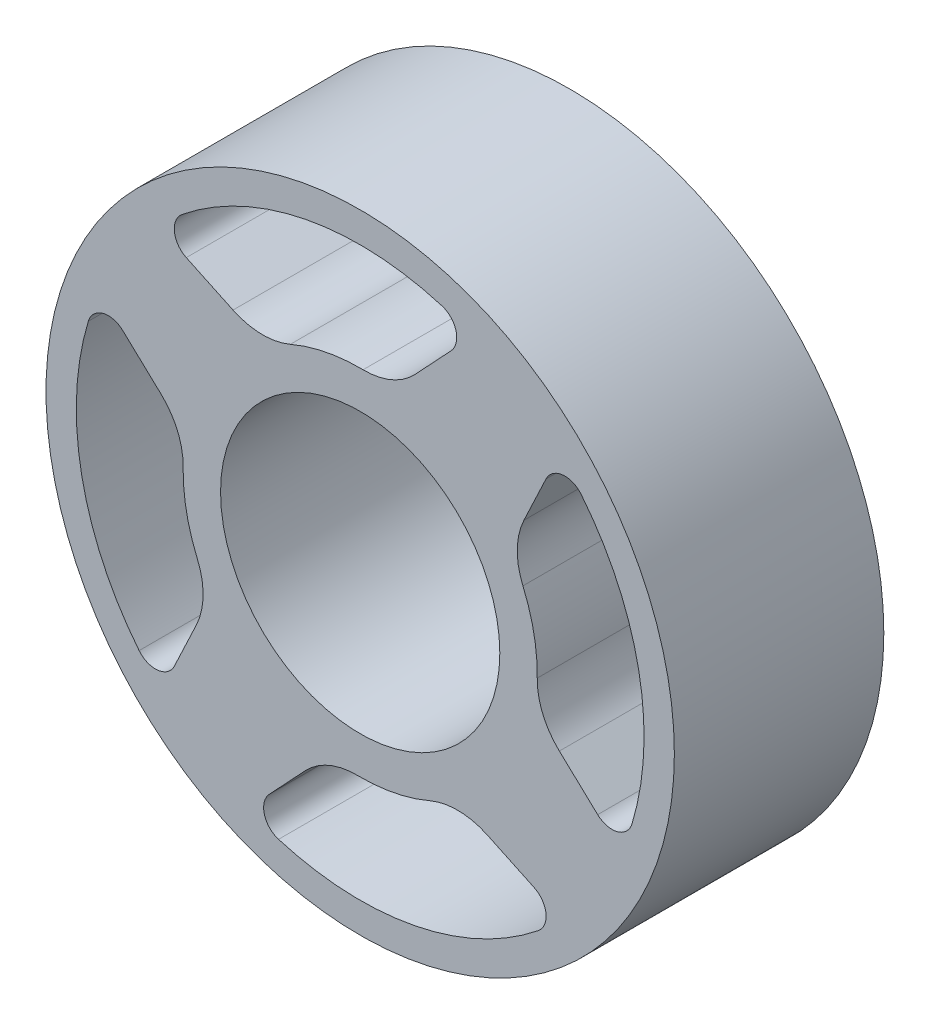
from build123d import *

# Parameters (mm, degrees)
SKETCH1_R           = 45
SKETCH1_R_2         = 20
BOSS_EXTRUDE1_DEPTH = 30
CUT_EXTRUDE1_DEPTH  = 30


with BuildPart() as part:
    # Sketch1 → Boss-Extrude1 (new body)
    with BuildSketch(Plane.XY):
        Circle(SKETCH1_R)
        Circle(SKETCH1_R_2, mode=Mode.SUBTRACT)
    extrude(amount=BOSS_EXTRUDE1_DEPTH)

    # Sketch2 → Cut-Extrude1 (cut)
    with BuildSketch(Plane.XY.offset(30)):
        with BuildLine():
            Line((-24.907553239, 26.610521963), (-18.211403795, 23.452988079))
            ThreePointArc((-18.211403795, 23.452988079), (-14.122579745, 22.499392212), (-10.002690574, 23.308305316))
            ThreePointArc((-10.002690574, 23.308305316), (-4.902050675, 24.885755255), (0.415790578, 25.360560594))
            ThreePointArc((0.415790578, 25.360560594), (4.483384622, 26.152621175), (7.880614817, 28.525701089))
            Line((7.880614817, 28.525701089), (13.020947118, 34.017606823))
            ThreePointArc((13.020947118, 34.017606823), (13.72723623, 36.848657497), (11.693481002, 38.940912716))
            ThreePointArc((11.693481002, 38.940912716), (-7.808912198, 39.901792835), (-25.510313511, 31.660007671))
            ThreePointArc((-25.510313511, 31.660007671), (-26.606889428, 28.968389927), (-24.907553239, 26.610521963))
        make_face()
        with BuildLine():
            Line((28.525701089, -7.880614817), (34.017606823, -13.020947118))
            ThreePointArc((34.017606823, -13.020947118), (36.848657497, -13.72723623), (38.940912716, -11.693481002))
            ThreePointArc((38.940912716, -11.693481002), (39.901792835, 7.808912198), (31.660007671, 25.510313511))
            ThreePointArc((31.660007671, 25.510313511), (28.968389927, 26.606889428), (26.610521963, 24.907553239))
            Line((26.610521963, 24.907553239), (23.452988079, 18.211403795))
            ThreePointArc((23.452988079, 18.211403795), (22.499392212, 14.122579745), (23.308305316, 10.002690574))
            ThreePointArc((23.308305316, 10.002690574), (24.885755255, 4.902050675), (25.360560594, -0.415790578))
            ThreePointArc((25.360560594, -0.415790578), (26.152621175, -4.483384622), (28.525701089, -7.880614817))
        make_face()
        with BuildLine():
            Line((-7.880614817, -28.525701089), (-13.020947118, -34.017606823))
            ThreePointArc((-13.020947118, -34.017606823), (-13.72723623, -36.848657497), (-11.693481002, -38.940912716))
            ThreePointArc((-11.693481002, -38.940912716), (7.808912198, -39.901792835), (25.510313511, -31.660007671))
            ThreePointArc((25.510313511, -31.660007671), (26.606889428, -28.968389927), (24.907553239, -26.610521963))
            Line((24.907553239, -26.610521963), (18.211403795, -23.452988079))
            ThreePointArc((18.211403795, -23.452988079), (14.122579745, -22.499392212), (10.002690574, -23.308305316))
            ThreePointArc((10.002690574, -23.308305316), (4.902050675, -24.885755255), (-0.415790578, -25.360560594))
            ThreePointArc((-0.415790578, -25.360560594), (-4.483384622, -26.152621175), (-7.880614817, -28.525701089))
        make_face()
        with BuildLine():
            Line((-28.525701089, 7.880614817), (-34.017606823, 13.020947118))
            ThreePointArc((-34.017606823, 13.020947118), (-36.848657497, 13.72723623), (-38.940912716, 11.693481002))
            ThreePointArc((-38.940912716, 11.693481002), (-39.901792835, -7.808912198), (-31.660007671, -25.510313511))
            ThreePointArc((-31.660007671, -25.510313511), (-28.968389927, -26.606889428), (-26.610521963, -24.907553239))
            Line((-26.610521963, -24.907553239), (-23.452988079, -18.211403795))
            ThreePointArc((-23.452988079, -18.211403795), (-22.499392212, -14.122579745), (-23.308305316, -10.002690574))
            ThreePointArc((-23.308305316, -10.002690574), (-24.885755255, -4.902050675), (-25.360560594, 0.415790578))
            ThreePointArc((-25.360560594, 0.415790578), (-26.152621175, 4.483384622), (-28.525701089, 7.880614817))
        make_face()
    extrude(amount=-CUT_EXTRUDE1_DEPTH, mode=Mode.SUBTRACT)


solid = part.part
